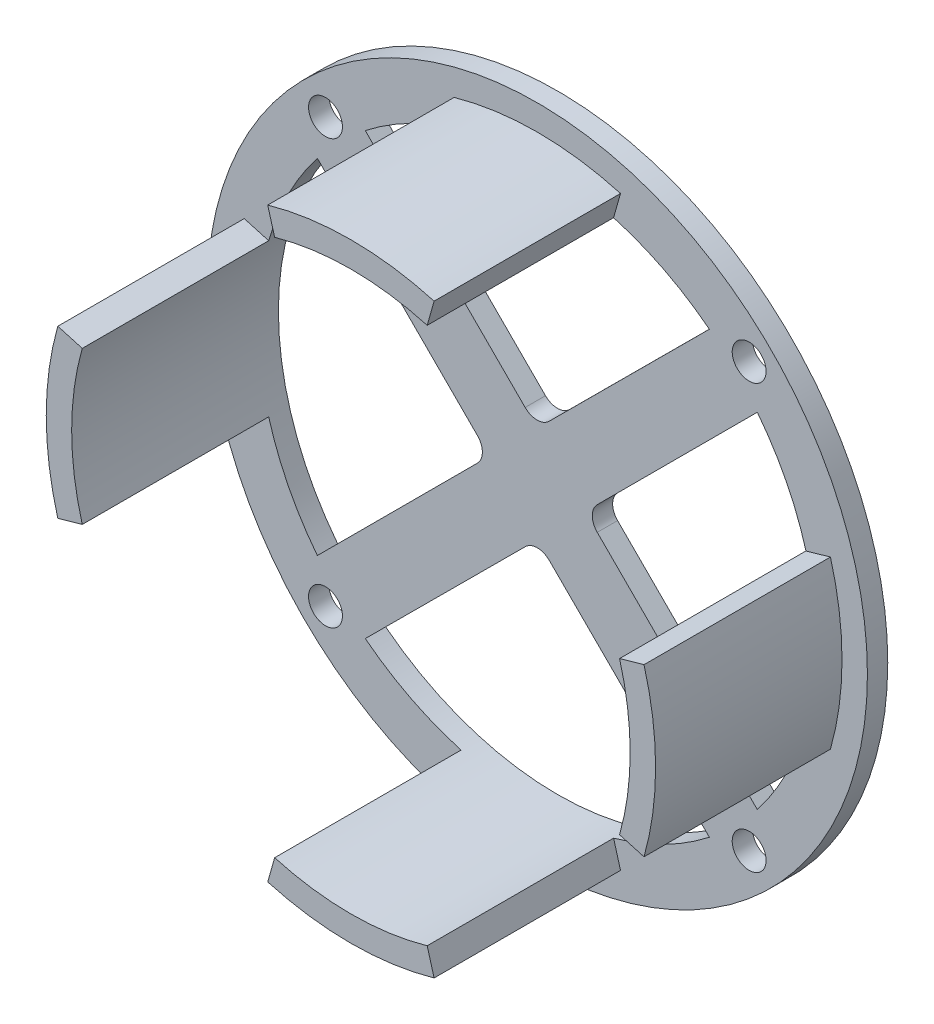
from build123d import *

# Parameters (mm, degrees)
SKETCH_4_R      = 19.479021456
SKETCH_4_R_2    = 1
EXTRUDE_1_DEPTH = 1.2
EXTRUDE_2_DEPTH = 11


with BuildPart() as part:
    # 草图4 → 凸台-拉伸1 (new body)
    with BuildSketch(Plane.XY):
        with Locations((-13.402062784, 0.00779119)):
            Circle(SKETCH_4_R)
        with Locations((-25.902062784, 12.50779119)):
            Circle(SKETCH_4_R_2, mode=Mode.SUBTRACT)
        with Locations((-0.902062784, 12.50779119)):
            Circle(SKETCH_4_R_2, mode=Mode.SUBTRACT)
        with Locations((-0.902062784, -12.49220881)):
            Circle(SKETCH_4_R_2, mode=Mode.SUBTRACT)
        with Locations((-25.902062784, -12.49220881)):
            Circle(SKETCH_4_R_2, mode=Mode.SUBTRACT)
        with BuildLine():
            Line((-0.421681224, -10.144442196), (-9.866508066, -0.699336529))
            ThreePointArc((-9.866508066, -0.699336529), (-10.159390847, 0.007774575), (-9.866487191, 0.714877033))
            Line((-9.866487191, 0.714877033), (-0.421408953, 10.159676447))
            ThreePointArc((-0.421408953, 10.159676447), (3.076958671, 0.007570212), (-0.421681224, -10.144442196))
        make_face(mode=Mode.SUBTRACT)
        with BuildLine():
            Line((-3.249794328, 12.988145321), (-12.707997878, 3.55452659))
            ThreePointArc((-12.707997878, 3.55452659), (-13.414834543, 3.262553175), (-14.121290651, 3.555446182))
            Line((-14.121290651, 3.555446182), (-23.554139641, 12.988295172))
            ThreePointArc((-23.554139641, 12.988295172), (-13.401941164, 16.486812646), (-3.249794328, 12.988145321))
        make_face(mode=Mode.SUBTRACT)
        with BuildLine():
            Line((-26.382444344, 10.160024576), (-16.937617502, 0.714918908))
            ThreePointArc((-16.937617502, 0.714918908), (-16.64473472, 0.007807804), (-16.937638376, -0.699294654))
            Line((-16.937638376, -0.699294654), (-26.382716615, -10.144094068))
            ThreePointArc((-26.382716615, -10.144094068), (-29.881084239, 0.008012168), (-26.382444344, 10.160024576))
        make_face(mode=Mode.SUBTRACT)
        with BuildLine():
            Line((-23.554331239, -12.972562941), (-14.108248776, -3.55103379))
            ThreePointArc((-14.108248776, -3.55103379), (-13.402062784, -3.259060163), (-12.695876792, -3.55103379))
            Line((-12.695876792, -3.55103379), (-3.249794328, -12.972562941))
            ThreePointArc((-3.249794328, -12.972562941), (-13.402062784, -16.471230267), (-23.554331239, -12.972562941))
        make_face(mode=Mode.SUBTRACT)
    extrude(amount=EXTRUDE_1_DEPTH)

    # 草图5 → 凸台-拉伸2 (add)
    with BuildSketch(Plane.XY.offset(1.2)):
        with BuildLine():
            Line((-17.902062784, -15.844910415), (-18.311674484, -17.287899762))
            ThreePointArc((-18.311674484, -17.287899762), (-13.402062784, -17.971230267), (-8.492451083, -17.287899762))
            Line((-8.492451083, -17.287899762), (-8.902062784, -15.844910415))
            ThreePointArc((-8.902062784, -15.844910415), (-13.402062784, -16.471230267), (-17.902062784, -15.844910415))
        make_face()
        with BuildLine():
            Line((-29.254764388, -4.49220881), (-30.697753735, -4.901820511))
            ThreePointArc((-30.697753735, -4.901820511), (-31.38108424, 0.00779119), (-30.697753735, 4.91740289))
            Line((-30.697753735, 4.91740289), (-29.254764388, 4.50779119))
            ThreePointArc((-29.254764388, 4.50779119), (-29.88108424, 0.00779119), (-29.254764388, -4.49220881))
        make_face()
        with BuildLine():
            Line((-17.902062784, 15.860492794), (-18.311674484, 17.303482141))
            ThreePointArc((-18.311674484, 17.303482141), (-13.402062784, 17.986812646), (-8.492451083, 17.303482141))
            Line((-8.492451083, 17.303482141), (-8.902062784, 15.860492794))
            ThreePointArc((-8.902062784, 15.860492794), (-13.402062784, 16.486812646), (-17.902062784, 15.860492794))
        make_face()
        with BuildLine():
            Line((2.450638821, 4.50779119), (3.893628168, 4.91740289))
            ThreePointArc((3.893628168, 4.91740289), (4.576958673, 0.00779119), (3.893628168, -4.901820511))
            Line((3.893628168, -4.901820511), (2.450638821, -4.49220881))
            ThreePointArc((2.450638821, -4.49220881), (3.076958673, 0.00779119), (2.450638821, 4.50779119))
        make_face()
    extrude(amount=EXTRUDE_2_DEPTH)


solid = part.part
